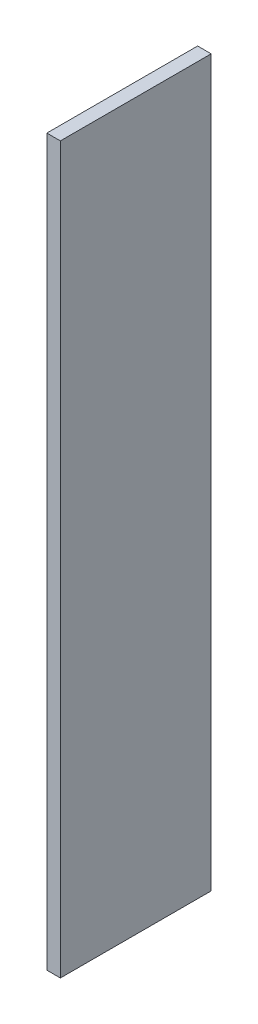
from build123d import *

# Parameters (mm, degrees)
SKETCH1_W           = 15.6
SKETCH1_H           = 75
BOSS_EXTRUDE4_DEPTH = 1.4


with BuildPart() as part:
    # Sketch1 → Boss-Extrude4 (new body)
    with BuildSketch(Plane(origin=(0, 0, 0), x_dir=(0, 0, -1), z_dir=(1, 0, 0))):
        Rectangle(SKETCH1_W, SKETCH1_H)
    extrude(amount=BOSS_EXTRUDE4_DEPTH)


solid = part.part
